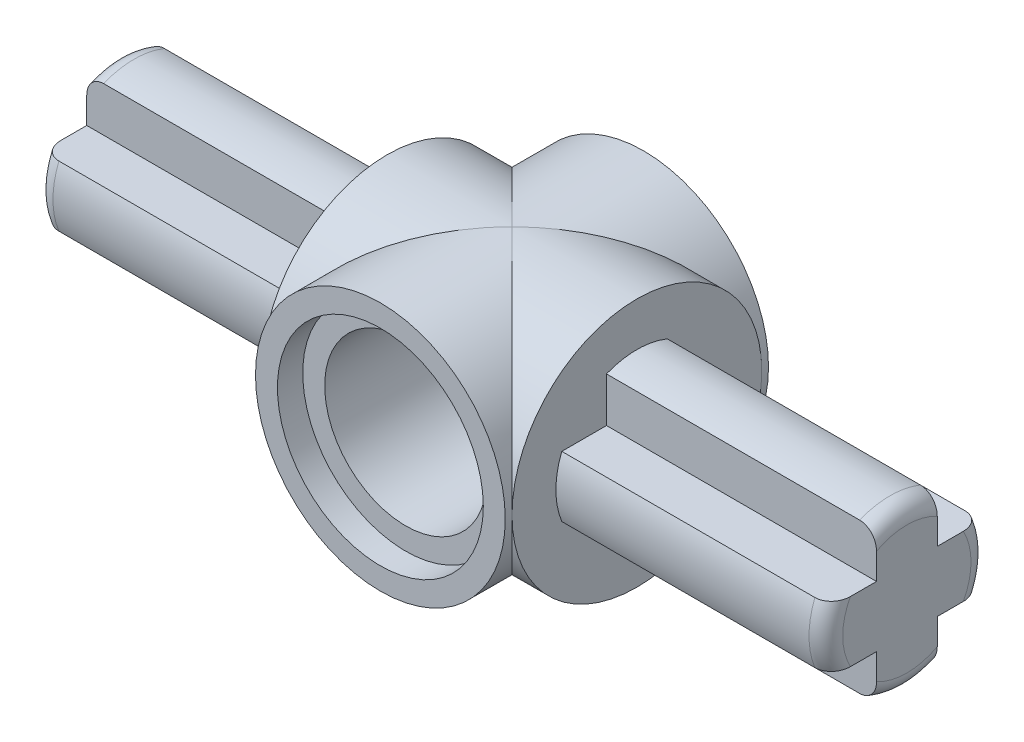
from build123d import *

# Parameters (mm, degrees)
SKETCH1_W              = 1.8
SKETCH1_H              = 1.8
PIN_DEPTH              = 11.7
SKETCH2_R              = 3.7
MIDDLE_DEPTH           = 3.7
SKETCH6_R              = 3.7
MIDDLE_BODY_DEPTH      = 3.9
MIDDLE_BORE_DEPTH      = 13.875946567
MIDDLE_BORE_DEPTH_BACK = 13.875946567
SKETCH7_R              = 2.4
SKETCH8_R              = 3.05
MIDDLE_RIM_CUT_DEPTH   = 0.75
FILLET1_R              = 0.5


with BuildPart() as part:
    # Sketch1 → Pin (new, symmetric)
    with BuildSketch(Plane(origin=(0, 0, 0), x_dir=(0, 0, -1), z_dir=(1, 0, 0))):
        with BuildLine():
            Line((-0.9, 0.9), (0.9, 0.9))
            Line((0.9, 0.9), (0.9, 2.224859546))
            ThreePointArc((0.9, 2.224859546), (0.45844143, 2.355808026), (0, 2.4))
            ThreePointArc((0, 2.4), (-0.45844143, 2.355808026), (-0.9, 2.224859546))
            Line((-0.9, 2.224859546), (-0.9, 0.9))
        make_face()
        Rectangle(SKETCH1_W, SKETCH1_H)
        with BuildLine():
            Line((-2.224859546, -0.9), (-0.9, -0.9))
            Line((-0.9, -0.9), (-0.9, 0.9))
            Line((-0.9, 0.9), (-2.224859546, 0.9))
            ThreePointArc((-2.224859546, 0.9), (-2.355808027, 0.458441425), (-2.4, -1e-08))
            ThreePointArc((-2.4, -1e-08), (-2.355808025, -0.458441435), (-2.224859546, -0.9))
        make_face()
        with BuildLine():
            ThreePointArc((-0.9, -2.224859546), (-0.45844143, -2.355808026), (0, -2.4))
            ThreePointArc((0, -2.4), (0.45844143, -2.355808026), (0.9, -2.224859546))
            Line((0.9, -2.224859546), (0.9, -0.9))
            Line((0.9, -0.9), (-0.9, -0.9))
            Line((-0.9, -0.9), (-0.9, -2.224859546))
        make_face()
        with BuildLine():
            Line((0.9, 0.9), (0.9, -0.9))
            Line((0.9, -0.9), (2.224859546, -0.9))
            ThreePointArc((2.224859546, -0.9), (2.355808026, -0.45844143), (2.4, 0))
            ThreePointArc((2.4, 0), (2.355808026, 0.45844143), (2.224859546, 0.9))
            Line((2.224859546, 0.9), (0.9, 0.9))
        make_face()
    extrude(amount=PIN_DEPTH, both=True)

    # Sketch2 → Middle (add, symmetric)
    with BuildSketch(Plane(origin=(0, 0, 0), x_dir=(0, 0, -1), z_dir=(1, 0, 0))):
        Circle(SKETCH2_R)
    extrude(amount=MIDDLE_DEPTH, both=True)

    # Sketch6 → Middle Body (add, symmetric)
    with BuildSketch(Plane.XY):
        Circle(SKETCH6_R)
    extrude(amount=MIDDLE_BODY_DEPTH, both=True)

    # Sketch7 → Middle Bore (cut, two sides: drawn at the far end of the back side and taken through both)
    with BuildSketch(Plane.XY.offset(-MIDDLE_BORE_DEPTH_BACK)):
        Circle(SKETCH7_R)
    extrude(amount=MIDDLE_BORE_DEPTH + MIDDLE_BORE_DEPTH_BACK, mode=Mode.SUBTRACT)

    # Sketch8 → Middle Rim Cut (cut)
    with BuildSketch(Plane.XY.offset(3.9)):
        Circle(SKETCH8_R)
    middle_rim_cut = extrude(amount=-MIDDLE_RIM_CUT_DEPTH, mode=Mode.SUBTRACT)

    # Mirror2: Middle Rim Cut across plane
    add(middle_rim_cut.mirror(Plane.XY), mode=Mode.SUBTRACT)

    # Fillet1
    fillet1_edges = [part.edges().sort_by_distance(p)[0] for p in [
        (11.7, 2.4, 0),
        (-11.7, 0, -2.4),
        (-11.7, -2.4, 0),
        (-11.7, 0, 2.4),
        (-11.7, 2.4, 0),
        (11.7, 0, 2.4),
        (11.7, -2.4, 0),
        (11.7, 0, -2.4),
    ]]
    fillet(fillet1_edges, radius=FILLET1_R)


solid = part.part
